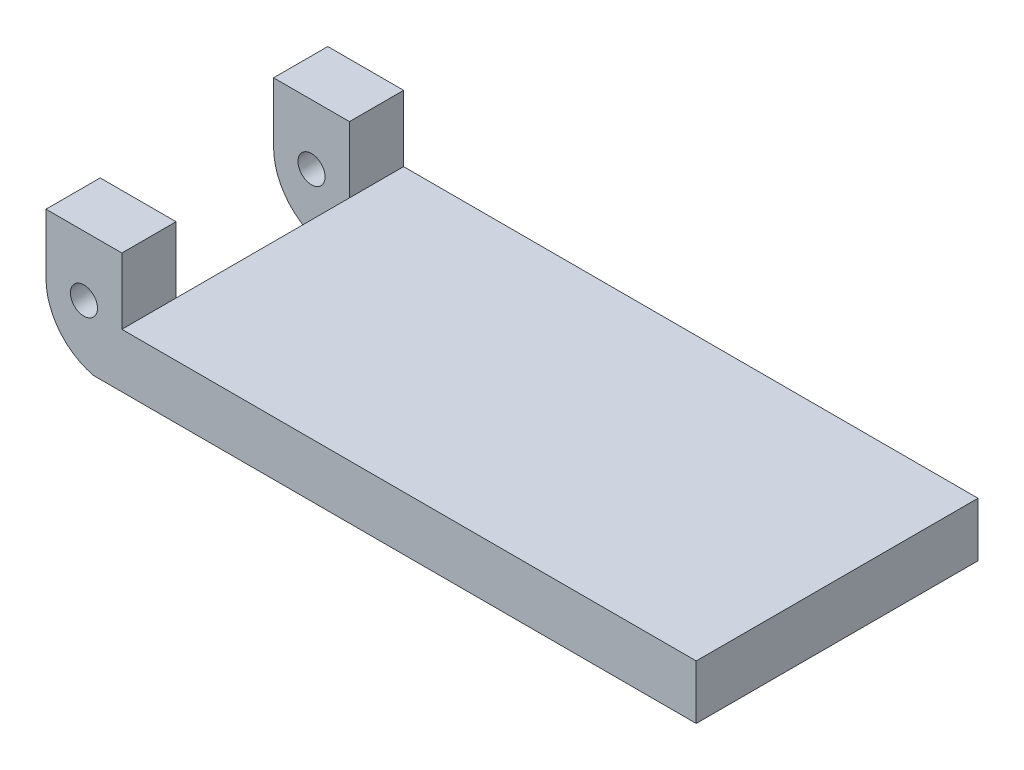
from build123d import *

# Parameters (mm, degrees)
BOSS_EXTRUDE1_DEPTH      = 13
BOSS_EXTRUDE1_DEPTH_BACK = 13
SKETCH1_W                = 53
SKETCH1_H                = 5
SKETCH2_W                = 7
SKETCH2_H                = 11.1
BOSS_EXTRUDE2_DEPTH      = 26
CUT_EXTRUDE1_DEPTH       = 8
CUT_EXTRUDE1_DEPTH_BACK  = 8
SKETCH3_W                = 7
SKETCH3_H                = 11.1
CUT_EXTRUDE3_START       = -26.000001
CUT_EXTRUDE3_DEPTH       = 26.000002
CUT_EXTRUDE5_REACH       = 62.068
SKETCH6_R                = 1.25
SKETCH7_W                = 50
SKETCH7_H                = 7.11
BOSS_EXTRUDE3_DEPTH      = 0.5


with BuildPart() as part:
    # Sketch1 → Boss-Extrude1 (new, two sides: drawn at the far end of the back side and taken through both)
    with BuildSketch(Plane.XY.offset(-BOSS_EXTRUDE1_DEPTH_BACK)):
        with Locations((26.5, 2.5)):
            Rectangle(SKETCH1_W, SKETCH1_H)
    extrude(amount=BOSS_EXTRUDE1_DEPTH + BOSS_EXTRUDE1_DEPTH_BACK)

    # Sketch2 → Boss-Extrude2 (add)
    with BuildSketch(Plane.XY.offset(13)):
        with Locations((-3.5, 5.55)):
            Rectangle(SKETCH2_W, SKETCH2_H)
    extrude(amount=-BOSS_EXTRUDE2_DEPTH)

    # Sketch3 → Cut-Extrude1 (cut, two sides: drawn at the far end of the back side and taken through both)
    with BuildSketch(Plane.XY.offset(-CUT_EXTRUDE1_DEPTH_BACK)):
        with Locations((-3.5, 5.55)):
            Rectangle(SKETCH3_W, SKETCH3_H)
    extrude(amount=CUT_EXTRUDE1_DEPTH + CUT_EXTRUDE1_DEPTH_BACK, mode=Mode.SUBTRACT)

    # Sketch5 → Cut-Extrude3 (cut)
    with BuildSketch(Plane.XY.offset(13).offset(CUT_EXTRUDE3_START)):
        with BuildLine():
            Line((-7, 0), (-2.615264285, 0))
            ThreePointArc((-2.615264285, 0), (-5.774039172, 2.011497403), (-7, 5.55))
            Line((-7, 5.55), (-7, 0))
        make_face()
    extrude(amount=CUT_EXTRUDE3_DEPTH, mode=Mode.SUBTRACT)

    # Cut-Extrude5: up to this face of the body (flat: up to its plane)
    cut_extrude5_end = Plane(part.part.faces().sort_by_distance((20.170778463, 3.227224149, -13))[0])
    # Sketch6 → Cut-Extrude5 (cut, up to the picked face)
    with BuildSketch(Plane.XY.offset(13), mode=Mode.PRIVATE) as cut_extrude5_sk1:
        with Locations(Location((-3.5, 5.55, 0), (0, 0, 180))):
            Circle(SKETCH6_R)
    cut_extrude5_tool1 = split(extrude(cut_extrude5_sk1.sketch, amount=-CUT_EXTRUDE5_REACH, mode=Mode.PRIVATE), bisect_by=cut_extrude5_end, keep=Keep.BOTH, mode=Mode.PRIVATE)
    add(cut_extrude5_tool1.solids().sort_by(Axis((-3.5, 5.55, 13), (0, 0, -1)))[0], mode=Mode.SUBTRACT)

    # Sketch7 → Boss-Extrude3 (add)
    with BuildSketch(Plane.XZ):
        with Locations((26.5, 0)):
            Rectangle(SKETCH7_W, SKETCH7_H)
    extrude(amount=BOSS_EXTRUDE3_DEPTH)


solid = part.part
